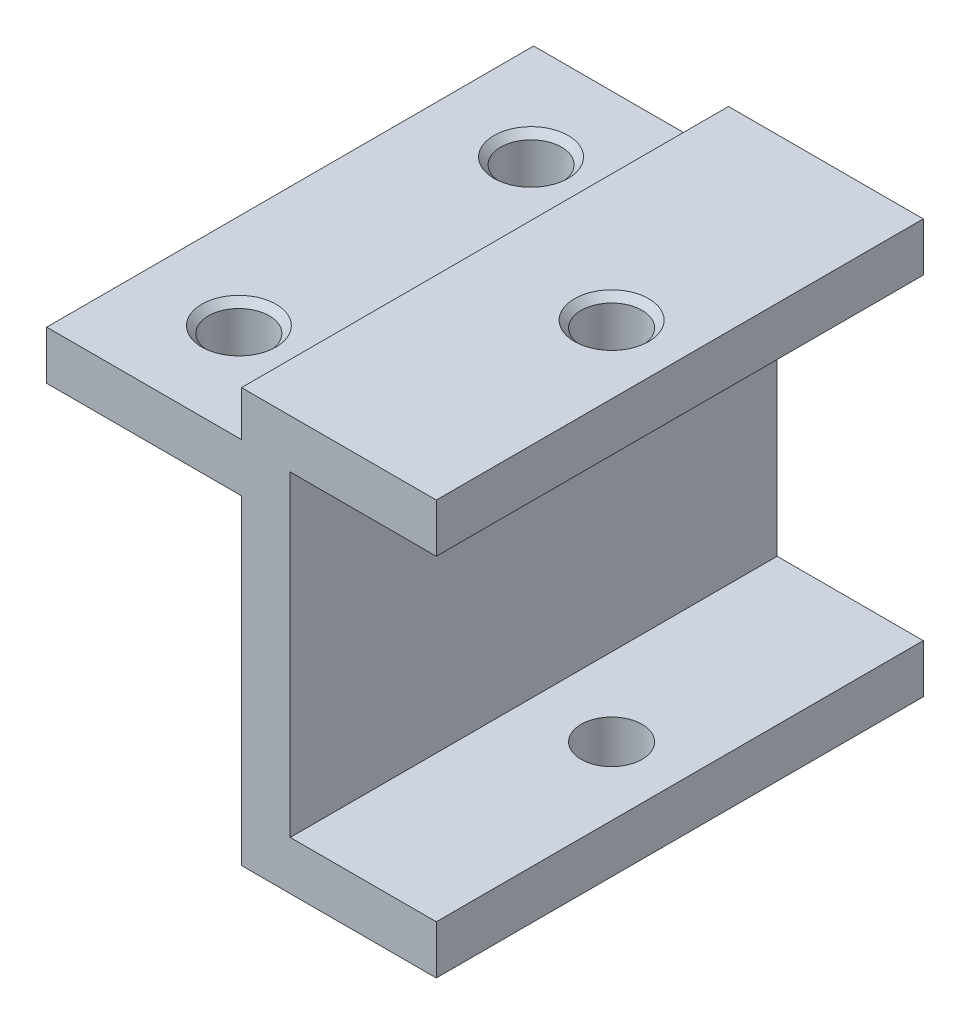
from build123d import *

# Parameters (mm, degrees)
BOSS_EXTRUDE1_DEPTH         = 20
M3_TAPPED_HOLE1_D           = 2.5
M3_TAPPED_HOLE1_CSINK_D     = 3.05
M3_TAPPED_HOLE1_CSINK_ANGLE = 90
M3_TAPPED_HOLE2_D           = 2.5
M3_TAPPED_HOLE2_CSINK_D     = 3.05
M3_TAPPED_HOLE2_CSINK_ANGLE = 90


with BuildPart() as part:
    # Sketch1 → Boss-Extrude1 (new body)
    with BuildSketch(Plane.XY):
        Polygon((2, 5.1), (4, 5.1), (4, 7.1), (-4, 7.1), (-4, 5.25), (-12, 5.25), (-12, 3.25), (-4, 3.25), (-4, -9.9), (4, -9.9), (4, -7.9), (2, -7.9), (-2, -7.9), (-2, 5.1), align=None)
    extrude(amount=BOSS_EXTRUDE1_DEPTH)

    # M3 Tapped Hole1 (through all)
    with Locations(Plane(origin=(-8.108371913, 5.25, 4), x_dir=(1, 0, 0), z_dir=(0, 1, 0))):
        with Locations((0, 0), (0, -12)):
            CounterSinkHole(M3_TAPPED_HOLE1_D / 2, M3_TAPPED_HOLE1_CSINK_D / 2, counter_sink_angle=M3_TAPPED_HOLE1_CSINK_ANGLE)

    # M3 Tapped Hole2 (through all)
    with Locations(Plane(origin=(1.2, 7.1, 10), x_dir=(0, 0, 1), z_dir=(0, 1, 0))):
        with Locations((0, 0)):
            CounterSinkHole(M3_TAPPED_HOLE2_D / 2, M3_TAPPED_HOLE2_CSINK_D / 2, counter_sink_angle=M3_TAPPED_HOLE2_CSINK_ANGLE)


solid = part.part
